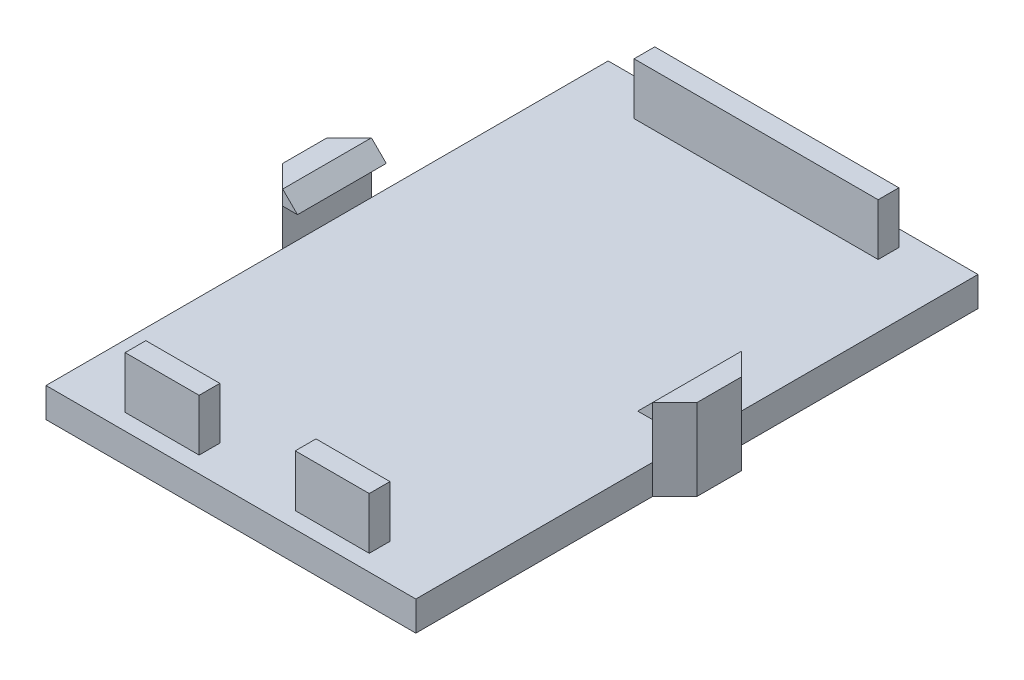
from build123d import *

# Parameters (mm, degrees)
SKETCH1_W                = 25
SKETCH1_H                = 38
SKETCH1_W_2              = 16.5
SKETCH1_H_2              = 1.4
BOSS_EXTRUDE1_DEPTH      = 2
SKETCH1_3_W              = 16.5
SKETCH1_3_H              = 1.4
BOSS_EXTRUDE2_DEPTH      = 5.5
BOSS_EXTRUDE3_DEPTH      = 3
BOSS_EXTRUDE3_DEPTH_BACK = 3
SKETCH3_W                = 6.5
SKETCH3_H                = 1.4
CUT_EXTRUDE1_DEPTH       = 3.5


with BuildPart() as part:
    # Sketch1 → Boss-Extrude1 (new body)
    with BuildSketch(Plane(origin=(0, 0, 0), x_dir=(1, 0, 0), z_dir=(0, 1, 0))):
        Rectangle(SKETCH1_W, SKETCH1_H)
        with Locations((0, -17.2)):
            Rectangle(SKETCH1_W_2, SKETCH1_H_2, mode=Mode.SUBTRACT)
        with Locations((0, 17.2)):
            Rectangle(SKETCH1_W_2, SKETCH1_H_2, mode=Mode.SUBTRACT)
    extrude(amount=BOSS_EXTRUDE1_DEPTH)

    # Sketch1<3> → Boss-Extrude2 (add)
    with BuildSketch(Plane(origin=(0, 0, 0), x_dir=(1, 0, 0), z_dir=(0, 1, 0))):
        Polygon((-14, -1.5), (-12.5, -3), (-12.5, 3), (-14, 1.5), align=None)
        Polygon((12.5, 3), (12.5, -3), (14, -1.5), (14, 1.5), align=None)
        with Locations((0, 17.2)):
            Rectangle(SKETCH1_3_W, SKETCH1_3_H)
        with Locations((0, -17.2)):
            Rectangle(SKETCH1_3_W, SKETCH1_3_H)
    extrude(amount=BOSS_EXTRUDE2_DEPTH)

    # Sketch2 → Boss-Extrude3 (add, two sides: drawn at the far end of the back side and taken through both)
    with BuildSketch(Plane.XY.offset(-BOSS_EXTRUDE3_DEPTH_BACK)):
        Polygon((12.5, 5.5), (11.5, 4.5), (12.5, 4.5), align=None)
        Polygon((-11.5, 4.5), (-12.5, 4.5), (-12.5, 5.5), align=None)
    extrude(amount=BOSS_EXTRUDE3_DEPTH + BOSS_EXTRUDE3_DEPTH_BACK)

    # Sketch3 → Cut-Extrude1 (cut)
    with BuildSketch(Plane(origin=(0, 2, 0), x_dir=(1, 0, 0), z_dir=(0, 1, 0))):
        with Locations((0, -17.2)):
            Rectangle(SKETCH3_W, SKETCH3_H)
    extrude(amount=CUT_EXTRUDE1_DEPTH, mode=Mode.SUBTRACT)


solid = part.part
